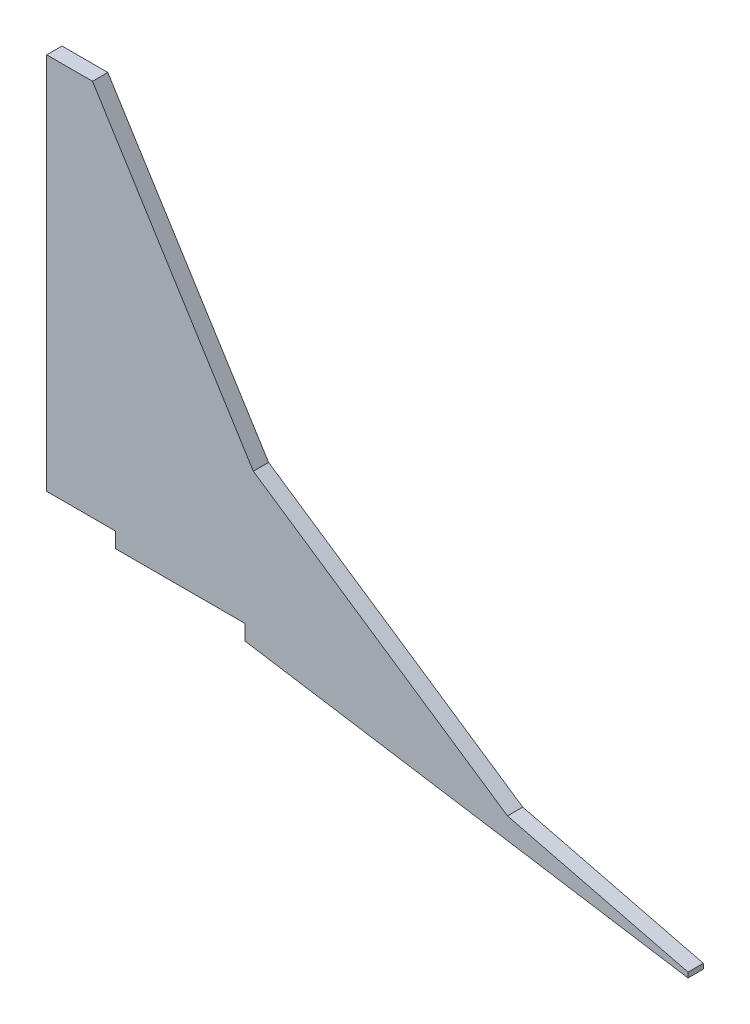
from build123d import *

# Parameters (mm, degrees)
FIVE_POINT_NOSE_SUPPORT_WEB_DEPTH = 1


with BuildPart() as part:
    # Five-point nose support web profile → Five-point nose support web (new body)
    with BuildSketch(Plane.XY):
        Polygon((94.5, 8), (103, 8), (103, 7), (132, 2.4), (132, 2.733396764), (120.173977577, 5.681955316), (103.529179441, 16.90901342), (93, 33.759222842), (90, 33.759222842), (90, 9), (94.5, 9), align=None)
    extrude(amount=FIVE_POINT_NOSE_SUPPORT_WEB_DEPTH)


solid = part.part
